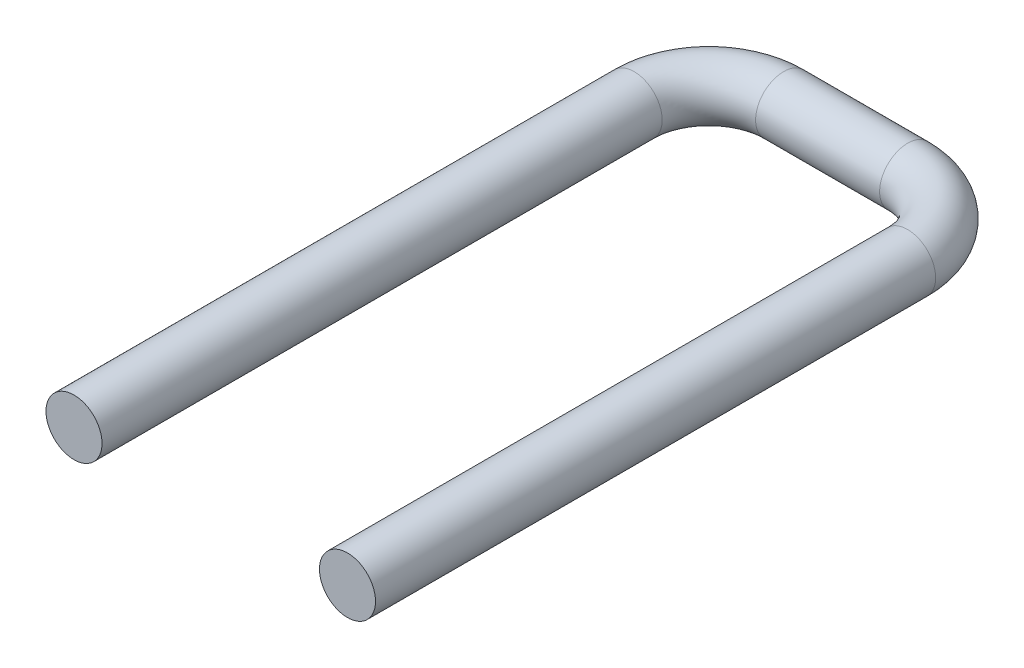
from build123d import *

# Parameters (mm, degrees)
SKETCH_7_R = 0.75


with BuildPart() as part:
    # По траектории9: sweep along a path in Эскиз1
    with BuildLine(Plane(origin=(0, 0, 0), x_dir=(1, 0, 0), z_dir=(0, 1, 0))) as sweep_9_path:
        Line((-2.921672053, 0.326690485), (-2.921672053, 15.31971545))
        ThreePointArc((-2.921672053, 15.31971545), (-2.335885615, 16.733929012), (-0.921672053, 17.31971545))
        Line((-0.921672053, 17.31971545), (2.398327947, 17.31971545))
        ThreePointArc((2.398327947, 17.31971545), (3.812541509, 16.733929012), (4.398327947, 15.31971545))
        Line((4.398327947, 15.31971545), (4.398327947, 0.326690485))
    # Эскиз7 → По траектории9 (sweep)
    with BuildSketch(Plane(origin=(-2.921672053, 0, -0.326690485), x_dir=(-1, 0, 0), z_dir=(0, 0, -1))):
        Circle(SKETCH_7_R)
    sweep(path=sweep_9_path.line)


solid = part.part
